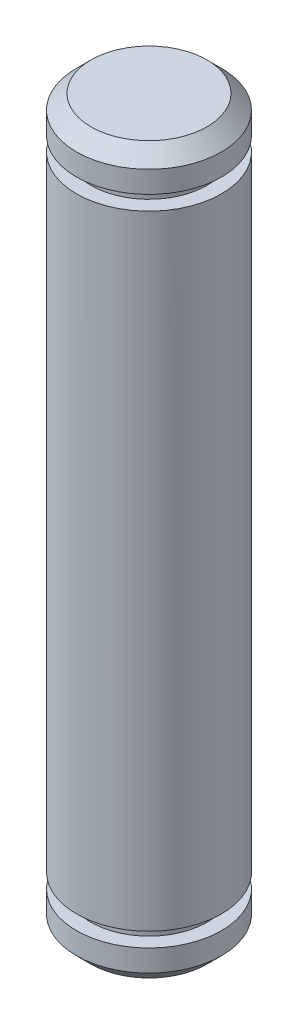
from build123d import *

# Parameters (mm, degrees)
SKETCH1_R           = 5
BOSS_EXTRUDE1_DEPTH = 50
CHAMFER1_SIZE       = 1
CUT_EXTRUDE1_START  = -2.5
SKETCH2_R           = 6
SKETCH2_R_2         = 4
CUT_EXTRUDE1_DEPTH  = 1
CUT_EXTRUDE2_START  = -3.5
SKETCH3_R           = 5
SKETCH3_R_2         = 4
CUT_EXTRUDE2_DEPTH  = 1


with BuildPart() as part:
    # Sketch1 → Boss-Extrude1 (new body)
    with BuildSketch(Plane(origin=(0, 0, 0), x_dir=(1, 0, 0), z_dir=(0, 1, 0))):
        with Locations(Location((0, 0, 0), (0, 0, 270))):
            Circle(SKETCH1_R)
    extrude(amount=BOSS_EXTRUDE1_DEPTH)

    # Chamfer1
    chamfer1_edges = [part.edges().sort_by_distance(p)[0] for p in [
        (0, 0, -5),
        (0, 50, -5),
    ]]
    chamfer(chamfer1_edges, length=CHAMFER1_SIZE)

    # Sketch2 → Cut-Extrude1 (cut)
    with BuildSketch(Plane.XZ.offset(CUT_EXTRUDE1_START)):
        Circle(SKETCH2_R)
        with Locations(Location((0, 0, 0), (0, 0, 270))):
            Circle(SKETCH2_R_2, mode=Mode.SUBTRACT)
    extrude(amount=-CUT_EXTRUDE1_DEPTH, mode=Mode.SUBTRACT)

    # Sketch3 → Cut-Extrude2 (cut)
    with BuildSketch(Plane(origin=(0, 50, 0), x_dir=(1, 0, 0), z_dir=(0, 1, 0)).offset(CUT_EXTRUDE2_START)):
        with Locations(Location((0, 0, 0), (0, 0, 90))):
            Circle(SKETCH3_R)
        with Locations(Location((0, 0, 0), (0, 0, 90))):
            Circle(SKETCH3_R_2, mode=Mode.SUBTRACT)
    extrude(amount=CUT_EXTRUDE2_DEPTH, mode=Mode.SUBTRACT)


solid = part.part
